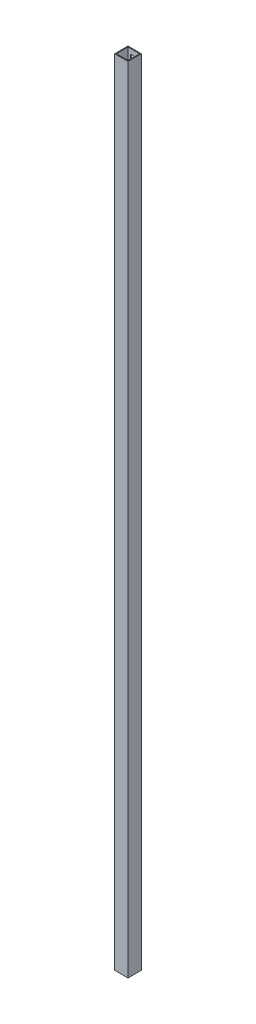
from build123d import *

# Parameters (mm, degrees)
SKETCH1_W           = 25.4
SKETCH1_H           = 25.4
SKETCH1_W_2         = 22.225
SKETCH1_H_2         = 22.225
BOSS_EXTRUDE1_DEPTH = 1511.3
CUT_EXTRUDE1_REACH  = 1513.567
SKETCH3_W           = 12.7
SKETCH3_H           = 6.35
LPATTERN1_COUNT     = 59
LPATTERN1_PITCH     = 25.4


with BuildPart() as part:
    # Sketch1 → Boss-Extrude1 (new body)
    with BuildSketch(Plane(origin=(0, 0, 0), x_dir=(1, 0, 0), z_dir=(0, 1, 0))):
        Rectangle(SKETCH1_W, SKETCH1_H)
        Rectangle(SKETCH1_W_2, SKETCH1_H_2, mode=Mode.SUBTRACT)
    extrude(amount=BOSS_EXTRUDE1_DEPTH)

    # Sketch3 → Cut-Extrude1 (cut, up to next)
    with BuildSketch(Plane(origin=(0, 0, -12.7), x_dir=(-1, 0, 0), z_dir=(0, 0, -1)), mode=Mode.PRIVATE) as cut_extrude1_sk1:
        with Locations((0, 1498.6)):
            Rectangle(SKETCH3_W, SKETCH3_H)
    cut_extrude1_tool1 = extrude(cut_extrude1_sk1.sketch, amount=-CUT_EXTRUDE1_REACH, mode=Mode.PRIVATE) & part.part
    cut_extrude1 = cut_extrude1_tool1.solids().sort_by_distance((0, 1498.6, -12.7))[0]
    add(cut_extrude1, mode=Mode.SUBTRACT)

    # LPattern1: Cut-Extrude1 ×59
    with Locations(*[(0, -i * LPATTERN1_PITCH, 0) for i in range(1, LPATTERN1_COUNT)]):
        add(cut_extrude1, mode=Mode.SUBTRACT)


solid = part.part
